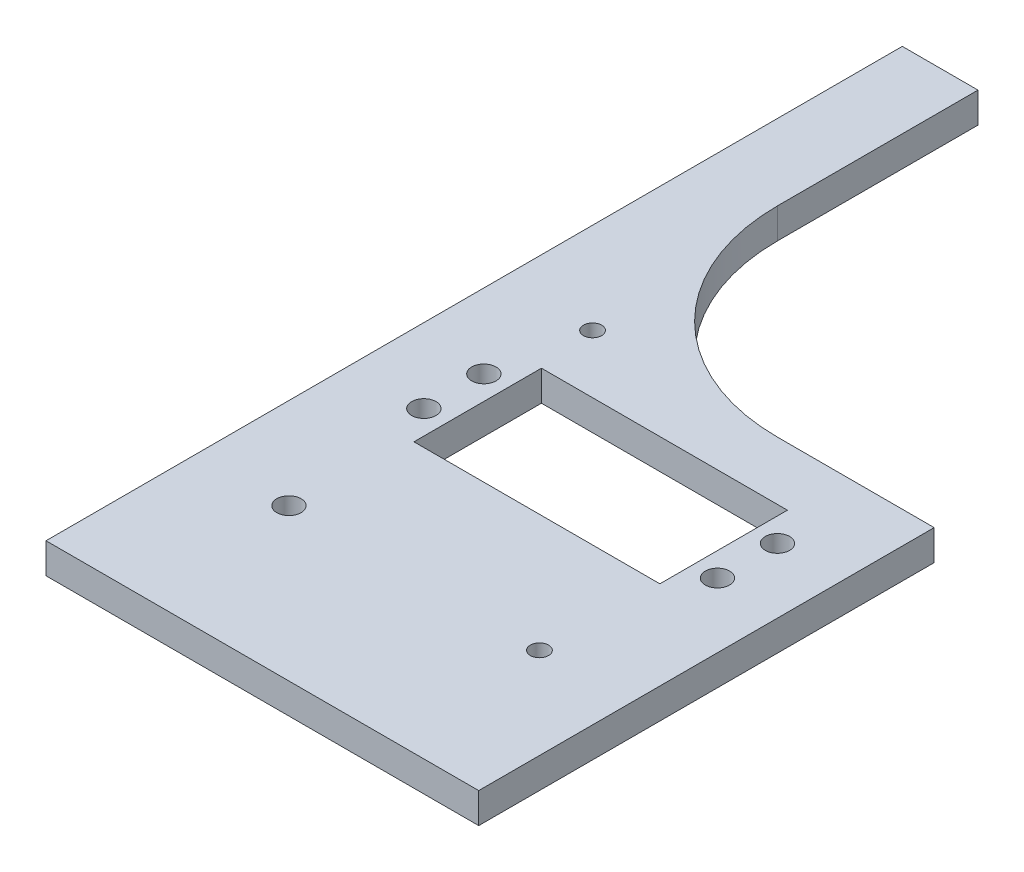
from build123d import *

# Parameters (mm, degrees)
SKETCH1_W           = 7.069644311
SKETCH1_H           = 9.6
SKETCH1_R           = 2
SKETCH1_R_2         = 1.5
BOSS_EXTRUDE1_DEPTH = 2.5


with BuildPart() as part:
    # Sketch1 → Boss-Extrude1 (new, symmetric)
    # profile 1 of 9: a face of its own
    with BuildSketch(Plane(origin=(0, 0, 0), x_dir=(1, 0, 0), z_dir=(0, 1, 0))):
        with BuildLine():
            ThreePointArc((-45.466733516, 15.387532074), (-41.115924877, 24.768542983), (-34.856850116, 33))
            Line((-34.856850116, 33), (-45.466733516, 33))
            Line((-45.466733516, 33), (-45.466733516, 15.387532074))
        make_face()
    # profile 2 of 9: a face of its own
    with BuildSketch(Plane(origin=(0, 0, 0), x_dir=(1, 0, 0), z_dir=(0, 1, 0))):
        with BuildLine():
            Line((-33, 33), (-34.856850116, 33))
            ThreePointArc((-34.856850116, 33), (-41.115924877, 24.768542983), (-45.466733516, 15.387532074))
            Line((-45.466733516, 15.387532074), (-45.466733516, 13.267794591))
            Line((-45.466733516, 13.267794591), (-33, 13.267794591))
            Line((-33, 13.267794591), (-33, 33))
        make_face()
    # profile 3 of 9: a face of its own
    with BuildSketch(Plane(origin=(0, 0, 0), x_dir=(1, 0, 0), z_dir=(0, 1, 0))):
        with BuildLine():
            Line((-33, 0), (-33, 13.267794591))
            Line((-33, 13.267794591), (-45.466733516, 13.267794591))
            Line((-45.466733516, 13.267794591), (-45.466733516, -15.387532074))
            ThreePointArc((-45.466733516, -15.387532074), (-41.115924877, -24.768542983), (-34.856850116, -33))
            Line((-34.856850116, -33), (-31.966733516, -33))
            ThreePointArc((-31.966733516, -33), (-30.466733516, -31.5), (-28.966733516, -33))
            Line((-28.966733516, -33), (0, -33))
            ThreePointArc((0, -33), (-23.334523779, -23.334523779), (-33, 0))
        make_face()
    # profile 4 of 9: a face of its own
    with BuildSketch(Plane(origin=(0, 0, 0), x_dir=(1, 0, 0), z_dir=(0, 1, 0))):
        with BuildLine():
            Line((-34.856850116, -33), (-45.466733516, -33))
            Line((-45.466733516, -33), (-45.466733516, -47.472549547))
            Line((-45.466733516, -47.472549547), (-35.084874053, -47.472549547))
            ThreePointArc((-35.084874053, -47.472549547), (-33.206733516, -46.16), (-31.32859298, -47.472549547))
            Line((-31.32859298, -47.472549547), (-29.283755862, -47.472549547))
            Line((-29.283755862, -47.472549547), (-29.283755862, -42.6))
            Line((-29.283755862, -42.6), (-22.118770309, -42.6))
            ThreePointArc((-22.118770309, -42.6), (-28.889363626, -38.332814523), (-34.856850116, -33))
        make_face()
    # profile 5 of 9: a face of its own
    with BuildSketch(Plane(origin=(0, 0, 0), x_dir=(1, 0, 0), z_dir=(0, 1, 0))):
        with BuildLine():
            ThreePointArc((-34.856850116, -33), (-41.115924877, -24.768542983), (-45.466733516, -15.387532074))
            Line((-45.466733516, -15.387532074), (-45.466733516, -33))
            Line((-45.466733516, -33), (-34.856850116, -33))
        make_face()
    # profile 6 of 9: a face of its own
    with BuildSketch(Plane(origin=(0, 0, 0), x_dir=(1, 0, 0), z_dir=(0, 1, 0))):
        with BuildLine():
            Line((0, -42.6), (0, -33))
            Line((0, -33), (-28.966733516, -33))
            ThreePointArc((-28.966733516, -33), (-30.466733516, -34.5), (-31.966733516, -33))
            Line((-31.966733516, -33), (-34.856850116, -33))
            ThreePointArc((-34.856850116, -33), (-28.889363626, -38.332814523), (-22.118770309, -42.6))
            Line((-22.118770309, -42.6), (0, -42.6))
        make_face()
    # profile 7 of 9: a face of its own
    with BuildSketch(Plane(origin=(0, 0, 0), x_dir=(1, 0, 0), z_dir=(0, 1, 0))):
        with Locations((3.534822156, -37.8)):
            Rectangle(SKETCH1_W, SKETCH1_H)
    # profile 8 of 9: a face of its own
    with BuildSketch(Plane(origin=(0, 0, 0), x_dir=(1, 0, 0), z_dir=(0, 1, 0))):
        with BuildLine():
            ThreePointArc((11.216244138, -46.671145984), (18.757980211, -44.183007802), (25.786244138, -40.485424701))
            Line((25.786244138, -40.485424701), (25.786244138, -33))
            Line((25.786244138, -33), (7.069644311, -33))
            Line((7.069644311, -33), (7.069644311, -42.6))
            Line((7.069644311, -42.6), (11.216244138, -42.6))
            Line((11.216244138, -42.6), (11.216244138, -46.671145984))
        make_face()
    # profile 9 of 9: a face of its own
    with BuildSketch(Plane(origin=(0, 0, 0), x_dir=(1, 0, 0), z_dir=(0, 1, 0))):
        with BuildLine():
            Line((25.786244138, -107.999697871), (25.786244138, -40.485424701))
            ThreePointArc((25.786244138, -40.485424701), (18.757980211, -44.183007802), (11.216244138, -46.671145984))
            Line((11.216244138, -46.671145984), (11.216244138, -63.6))
            Line((11.216244138, -63.6), (-29.283755862, -63.6))
            Line((-29.283755862, -63.6), (-29.283755862, -47.472549547))
            Line((-29.283755862, -47.472549547), (-31.32859298, -47.472549547))
            ThreePointArc((-31.32859298, -47.472549547), (-31.237434013, -47.810916251), (-31.206733516, -48.16))
            ThreePointArc((-31.206733516, -48.16), (-33.555817265, -50.129299504), (-35.084874053, -47.472549547))
            Line((-35.084874053, -47.472549547), (-45.466733516, -47.472549547))
            Line((-45.466733516, -47.472549547), (-45.466733516, -107.999697871))
            Line((-45.466733516, -107.999697871), (25.786244138, -107.999697871))
        make_face()
        with Locations(Location((-30.463755862, -83, 0), (0, 0, 270))):
            Circle(SKETCH1_R, mode=Mode.SUBTRACT)
        with Locations(Location((-33.206733516, -58.04, 0), (0, 0, 270))):
            Circle(SKETCH1_R, mode=Mode.SUBTRACT)
        with Locations(Location((10.786244138, -83, 0), (0, 0, 270))):
            Circle(SKETCH1_R_2, mode=Mode.SUBTRACT)
        with Locations(Location((15.136244138, -58.04, 0), (0, 0, 270))):
            Circle(SKETCH1_R, mode=Mode.SUBTRACT)
        with Locations(Location((15.136244138, -48.16, 0), (0, 0, 270))):
            Circle(SKETCH1_R, mode=Mode.SUBTRACT)
    extrude(amount=BOSS_EXTRUDE1_DEPTH, both=True)


solid = part.part
